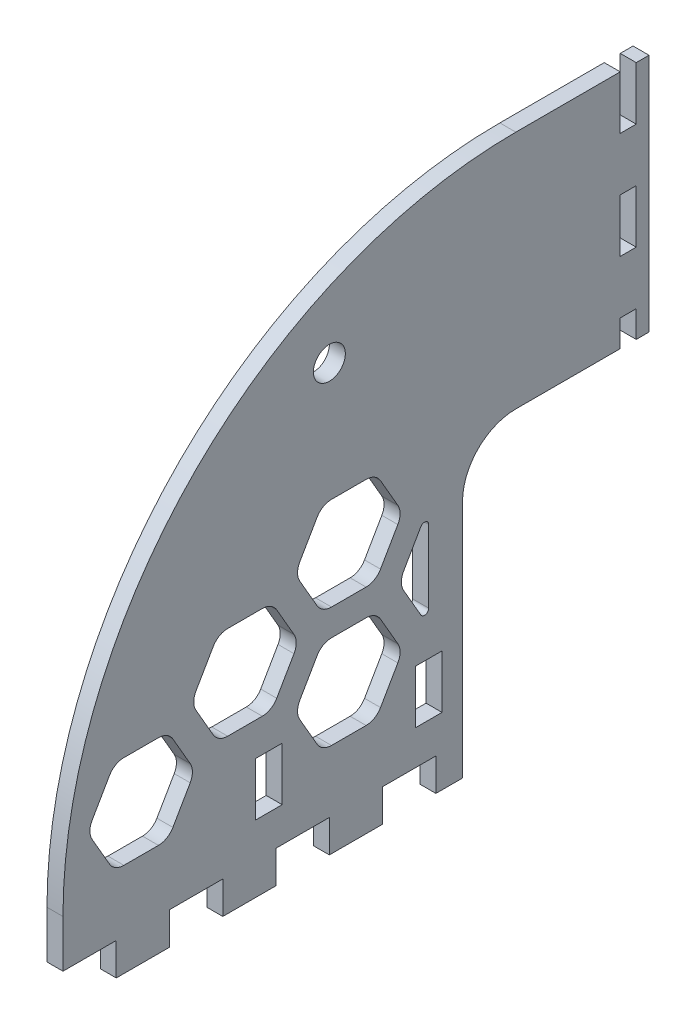
from build123d import *

# Parameters (mm, degrees)
SKETCH1_R               = 3
BOSS_EXTRUDE1_DEPTH     = 3
CUT_EXTRUDE1_DEPTH      = 149.690954668
CUT_EXTRUDE1_DEPTH_BACK = 149.690954668
CUT_EXTRUDE2_DEPTH      = 149.690954668
CUT_EXTRUDE2_DEPTH_BACK = 149.690954668
SKETCH4_W               = 10
SKETCH4_H               = 6.1
CUT_EXTRUDE3_DEPTH      = 149.690954668
CUT_EXTRUDE3_DEPTH_BACK = 149.690954668
SKETCH5_W               = 5
SKETCH5_H               = 10
SKETCH6_W               = 3
SKETCH6_H               = 10
SKETCH6_H_2             = 15
CUT_EXTRUDE4_DEPTH      = 149.690954668
CUT_EXTRUDE5_DEPTH      = 149.690954668


with BuildPart() as part:
    # Sketch1 → Boss-Extrude1 (new body)
    with BuildSketch(Plane(origin=(0, 0, 0), x_dir=(0, 0, -1), z_dir=(1, 0, 0))):
        with BuildLine():
            Line((0, 0), (110, 0))
            Line((110, 0), (110, 100))
            Line((110, 100), (85, 100))
            ThreePointArc((85, 100), (24.895923599, 75.104076401), (0, 15))
            Line((0, 15), (0, 0))
        make_face()
        with Locations((50, 80)):
            Circle(SKETCH1_R, mode=Mode.SUBTRACT)
    extrude(amount=BOSS_EXTRUDE1_DEPTH)

    # Sketch2 → Cut-Extrude1 (cut, two sides: drawn at the far end of the back side and taken through both)
    with BuildSketch(Plane(origin=(3, 0, 0), x_dir=(0, 0, -1), z_dir=(1, 0, 0)).offset(-CUT_EXTRUDE1_DEPTH_BACK)):
        with BuildLine():
            Line((110, 0), (75, 0))
            Line((75, 0), (75, 45))
            ThreePointArc((75, 45), (77.928932188, 52.071067812), (85, 55))
            Line((85, 55), (110, 55))
            Line((110, 55), (110, 0))
        make_face()
    extrude(amount=CUT_EXTRUDE1_DEPTH + CUT_EXTRUDE1_DEPTH_BACK, mode=Mode.SUBTRACT)

    # Sketch4 → Cut-Extrude2 (cut, two sides: drawn at the far end of the back side and taken through both)
    with BuildSketch(Plane(origin=(3, 0, 0), x_dir=(0, 0, -1), z_dir=(1, 0, 0)).offset(-CUT_EXTRUDE2_DEPTH_BACK)):
        with Locations((25, 3.05)):
            Rectangle(SKETCH4_W, SKETCH4_H)
        with Locations((5, 3.05)):
            Rectangle(SKETCH4_W, SKETCH4_H)
        with Locations((45, 3.05)):
            Rectangle(SKETCH4_W, SKETCH4_H)
        with Locations((65, 3.05)):
            Rectangle(SKETCH4_W, SKETCH4_H)
    extrude(amount=CUT_EXTRUDE2_DEPTH + CUT_EXTRUDE2_DEPTH_BACK, mode=Mode.SUBTRACT)

    # Sketch5 → Cut-Extrude3 (cut, two sides: drawn at the far end of the back side and taken through both)
    with BuildSketch(Plane.ZY.offset(-CUT_EXTRUDE3_DEPTH_BACK)):
        with Locations((-68.65, 17.6)):
            Rectangle(SKETCH5_W, SKETCH5_H)
        with Locations((-38.65, 17.6)):
            Rectangle(SKETCH5_W, SKETCH5_H)
    extrude(amount=CUT_EXTRUDE3_DEPTH + CUT_EXTRUDE3_DEPTH_BACK, mode=Mode.SUBTRACT)

    # Sketch6 → Cut-Extrude4 (cut, through all)
    with BuildSketch(Plane(origin=(3, 0, 0), x_dir=(0, 0, -1), z_dir=(1, 0, 0))):
        with Locations((106.1, 95)):
            Rectangle(SKETCH6_W, SKETCH6_H)
        with Locations((106.1, 75)):
            Rectangle(SKETCH6_W, SKETCH6_H)
        with Locations((106.1, 52.5)):
            Rectangle(SKETCH6_W, SKETCH6_H_2)
    extrude(amount=-CUT_EXTRUDE4_DEPTH, mode=Mode.SUBTRACT)

    # Sketch7 → Cut-Extrude5 (cut, through all)
    with BuildSketch(Plane(origin=(3, 0, 0), x_dir=(0, 0, -1), z_dir=(1, 0, 0))):
        with BuildLine():
            Line((62.851519915, 50.4125), (59.603924651, 56.0375))
            ThreePointArc((59.603924651, 56.0375), (58.460095264, 57.181329387), (56.897595264, 57.6))
            Line((56.897595264, 57.6), (50.402404736, 57.6))
            ThreePointArc((50.402404736, 57.6), (48.839904736, 57.181329387), (47.696075349, 56.0375))
            Line((47.696075349, 56.0375), (44.448480085, 50.4125))
            ThreePointArc((44.448480085, 50.4125), (44.029809472, 48.85), (44.448480085, 47.2875))
            Line((44.448480085, 47.2875), (47.696075349, 41.6625))
            ThreePointArc((47.696075349, 41.6625), (48.839904736, 40.518670613), (50.402404736, 40.1))
            Line((50.402404736, 40.1), (56.897595264, 40.1))
            ThreePointArc((56.897595264, 40.1), (58.460095264, 40.518670613), (59.603924651, 41.6625))
            Line((59.603924651, 41.6625), (62.851519915, 47.2875))
            ThreePointArc((62.851519915, 47.2875), (63.270190528, 48.85), (62.851519915, 50.4125))
        make_face()
        with BuildLine():
            Line((67.181646934, 44.7875), (63.93405167, 39.1625))
            ThreePointArc((63.93405167, 39.1625), (63.515381057, 37.6), (63.93405167, 36.0375))
            Line((63.93405167, 36.0375), (67.181646934, 30.4125))
            ThreePointArc((67.181646934, 30.4125), (68.06043166, 30.048495448), (68.639479281, 30.803125))
            Line((68.639479281, 30.803125), (68.639479281, 44.396875))
            ThreePointArc((68.639479281, 44.396875), (68.06043166, 45.151504552), (67.181646934, 44.7875))
        make_face()
        with BuildLine():
            Line((62.851519915, 27.9125), (59.603924651, 33.5375))
            ThreePointArc((59.603924651, 33.5375), (58.460095264, 34.681329387), (56.897595264, 35.1))
            Line((56.897595264, 35.1), (50.402404736, 35.1))
            ThreePointArc((50.402404736, 35.1), (48.839904736, 34.681329387), (47.696075349, 33.5375))
            Line((47.696075349, 33.5375), (44.448480085, 27.9125))
            ThreePointArc((44.448480085, 27.9125), (44.029809472, 26.35), (44.448480085, 24.7875))
            Line((44.448480085, 24.7875), (47.696075349, 19.1625))
            ThreePointArc((47.696075349, 19.1625), (48.839904736, 18.018670613), (50.402404736, 17.6))
            Line((50.402404736, 17.6), (56.897595264, 17.6))
            ThreePointArc((56.897595264, 17.6), (58.460095264, 18.018670613), (59.603924651, 19.1625))
            Line((59.603924651, 19.1625), (62.851519915, 24.7875))
            ThreePointArc((62.851519915, 24.7875), (63.270190528, 26.35), (62.851519915, 27.9125))
        make_face()
        with BuildLine():
            Line((43.36594833, 39.1625), (40.118353066, 44.7875))
            ThreePointArc((40.118353066, 44.7875), (38.974523679, 45.931329387), (37.412023679, 46.35))
            Line((37.412023679, 46.35), (30.916833151, 46.35))
            ThreePointArc((30.916833151, 46.35), (29.354333151, 45.931329387), (28.210503764, 44.7875))
            Line((28.210503764, 44.7875), (24.9629085, 39.1625))
            ThreePointArc((24.9629085, 39.1625), (24.544237886, 37.6), (24.9629085, 36.0375))
            Line((24.9629085, 36.0375), (28.210503764, 30.4125))
            ThreePointArc((28.210503764, 30.4125), (29.354333151, 29.268670613), (30.916833151, 28.85))
            Line((30.916833151, 28.85), (37.412023679, 28.85))
            ThreePointArc((37.412023679, 28.85), (38.974523679, 29.268670613), (40.118353066, 30.4125))
            Line((40.118353066, 30.4125), (43.36594833, 36.0375))
            ThreePointArc((43.36594833, 36.0375), (43.784618943, 37.6), (43.36594833, 39.1625))
        make_face()
        with BuildLine():
            Line((23.880376745, 27.9125), (20.632781481, 33.5375))
            ThreePointArc((20.632781481, 33.5375), (19.488952094, 34.681329387), (17.926452094, 35.1))
            Line((17.926452094, 35.1), (11.431261566, 35.1))
            ThreePointArc((11.431261566, 35.1), (9.868761566, 34.681329387), (8.724932179, 33.5375))
            Line((8.724932179, 33.5375), (5.477336915, 27.9125))
            ThreePointArc((5.477336915, 27.9125), (5.058666301, 26.35), (5.477336915, 24.7875))
            Line((5.477336915, 24.7875), (8.724932179, 19.1625))
            ThreePointArc((8.724932179, 19.1625), (9.868761566, 18.018670613), (11.431261566, 17.6))
            Line((11.431261566, 17.6), (17.926452094, 17.6))
            ThreePointArc((17.926452094, 17.6), (19.488952094, 18.018670613), (20.632781481, 19.1625))
            Line((20.632781481, 19.1625), (23.880376745, 24.7875))
            ThreePointArc((23.880376745, 24.7875), (24.299047358, 26.35), (23.880376745, 27.9125))
        make_face()
    extrude(amount=-CUT_EXTRUDE5_DEPTH, mode=Mode.SUBTRACT)


solid = part.part
